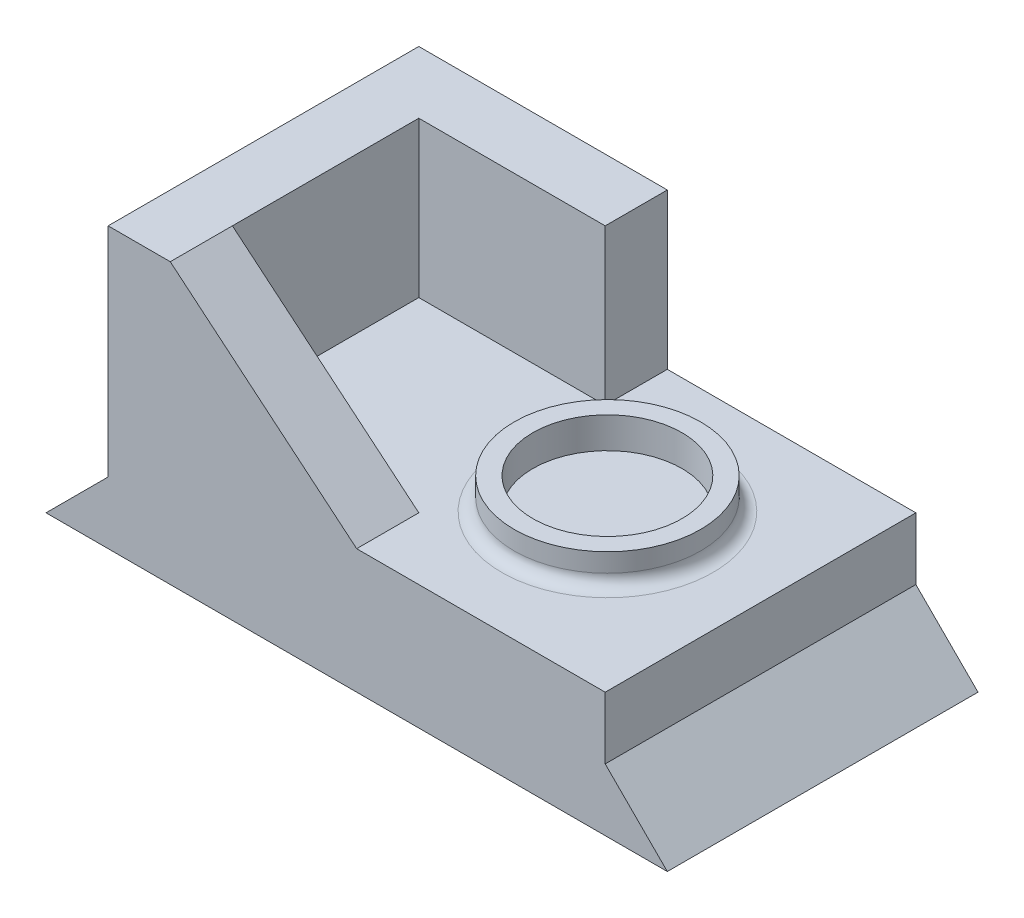
from build123d import *

# Parameters (mm, degrees)
BOSS_EXTRU_1_DEPTH      = 50
ENL_V_MAT_EXTRU_1_DEPTH = 121.519707932
ENL_V_MAT_EXTRU_2_DEPTH = 121.519707932
ESQUISSE5_W             = 30
ESQUISSE5_H             = 25
ENL_V_MAT_EXTRU_3_DEPTH = 30
ENL_V_MAT_EXTRU_4_DEPTH = 10
ESQUISSE7_R             = 15
ESQUISSE7_R_2           = 12
BOSS_EXTRU_2_DEPTH      = 5
CONG_1_R                = 2


with BuildPart() as part:
    # Esquisse2 → Boss.-Extru.1 (new body)
    with BuildSketch(Plane.XY):
        Polygon((0, 0), (100, 0), (100, 20), (50, 20), (50, 45), (0, 45), align=None)
    extrude(amount=-BOSS_EXTRU_1_DEPTH)

    # Esquisse3 → Enlèv. mat.-Extru.1 (cut, through all)
    with BuildSketch(Plane.XY):
        Polygon((0, 45), (10, 45), (10, 10), (0, 0), align=None)
    extrude(amount=-ENL_V_MAT_EXTRU_1_DEPTH, mode=Mode.SUBTRACT)

    # Esquisse4 → Enlèv. mat.-Extru.2 (cut, through all)
    with BuildSketch(Plane.XY):
        Polygon((100, 20), (90, 20), (90, 10), (100, 0), align=None)
    extrude(amount=-ENL_V_MAT_EXTRU_2_DEPTH, mode=Mode.SUBTRACT)

    # Esquisse5 → Enlèv. mat.-Extru.3 (cut)
    with BuildSketch(Plane(origin=(50, 0, 0), x_dir=(0, 0, -1), z_dir=(1, 0, 0))):
        with Locations((25, 32.5)):
            Rectangle(ESQUISSE5_W, ESQUISSE5_H)
    extrude(amount=-ENL_V_MAT_EXTRU_3_DEPTH, mode=Mode.SUBTRACT)

    # Esquisse6 → Enlèv. mat.-Extru.4 (cut)
    with BuildSketch(Plane.XY):
        Polygon((50, 45), (50, 20), (20, 45), align=None)
    extrude(amount=-ENL_V_MAT_EXTRU_4_DEPTH, mode=Mode.SUBTRACT)

    # Esquisse7 → Boss.-Extru.2 (add)
    with BuildSketch(Plane(origin=(0, 20, 0), x_dir=(1, 0, 0), z_dir=(0, 1, 0))):
        with Locations(Location((65, 25.357067419, 0), (0, 0, 180))):
            Circle(ESQUISSE7_R)
        with Locations(Location((65, 25.357067419, 0), (0, 0, 180))):
            Circle(ESQUISSE7_R_2, mode=Mode.SUBTRACT)
    extrude(amount=BOSS_EXTRU_2_DEPTH)

    # Congé1
    cong_1_edges = [part.edges().sort_by_distance(p)[0] for p in [
        (80, 20, -25.357067419),
    ]]
    fillet(cong_1_edges, radius=CONG_1_R)


solid = part.part
